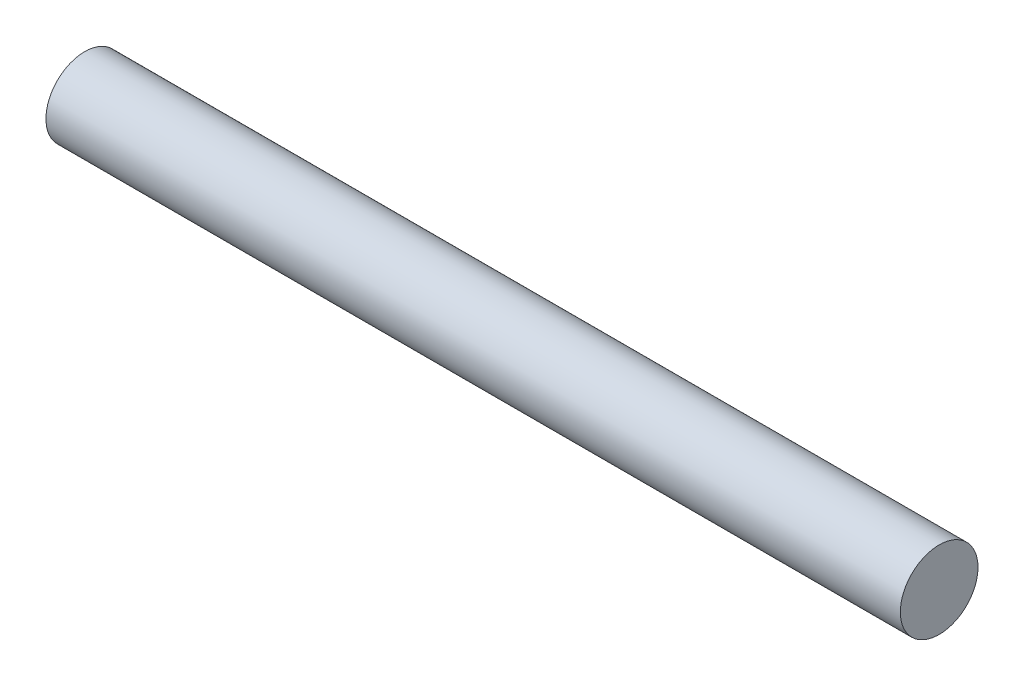
from build123d import *

# Parameters (mm, degrees)
SKETCH1_R           = 1
BOSS_EXTRUDE1_DEPTH = 22


with BuildPart() as part:
    # Sketch1 → Boss-Extrude1 (new body)
    with BuildSketch(Plane(origin=(0, 0, 0), x_dir=(0, 0, -1), z_dir=(1, 0, 0))):
        Circle(SKETCH1_R)
    extrude(amount=BOSS_EXTRUDE1_DEPTH)


solid = part.part
